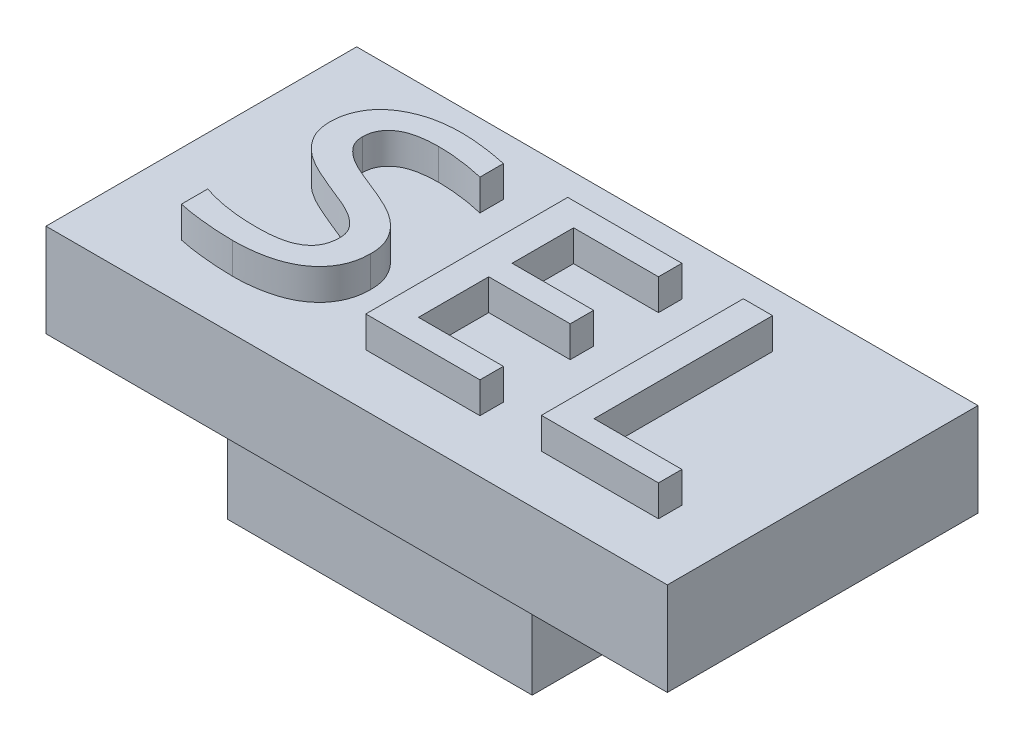
from build123d import *

# Parameters (mm, degrees)
SKETCH1_W           = 20
SKETCH1_H           = 10
BOSS_EXTRUDE1_DEPTH = 3
SKETCH2_W           = 9.8
SKETCH2_H           = 8.5
SKETCH2_W_2         = 5.8
SKETCH2_H_2         = 4.5
BOSS_EXTRUDE2_DEPTH = 3
BOSS_EXTRUDE3_DEPTH = 1


with BuildPart() as part:
    # Sketch1 → Boss-Extrude1 (new body)
    with BuildSketch(Plane(origin=(0, 0, 0), x_dir=(1, 0, 0), z_dir=(0, 1, 0))):
        Rectangle(SKETCH1_W, SKETCH1_H)
    extrude(amount=BOSS_EXTRUDE1_DEPTH)

    # Sketch2 → Boss-Extrude2 (add)
    with BuildSketch(Plane.XZ):
        Rectangle(SKETCH2_W, SKETCH2_H)
        Rectangle(SKETCH2_W_2, SKETCH2_H_2, mode=Mode.SUBTRACT)
    extrude(amount=BOSS_EXTRUDE2_DEPTH)

    # Sketch3 → Boss-Extrude3 (add)
    with BuildSketch(Plane(origin=(0, 3, 0), x_dir=(1, 0, 0), z_dir=(0, 1, 0))):
        with BuildLine():
            add(Edge.make_bspline(
                [(-3.007246377, -1.541055254), (-3.009361723, -1.616266832), (-3.01346546, -1.762176027), (-3.049571221, -1.974490768), (-3.109784234, -2.171698983), (-3.192526507, -2.355150602), (-3.298968583, -2.521513857), (-3.420549524, -2.676791882), (-3.565727351, -2.813375097), (-3.726560117, -2.937740496), (-3.905559946, -3.047190671), (-4.103184871, -3.139302997), (-4.316725708, -3.21887973), (-4.54677574, -3.283042654), (-4.79127798, -3.332920655), (-5.049025563, -3.367185197), (-5.318723514, -3.390311379), (-5.502591678, -3.39288864), (-5.596354167, -3.394202899)],
                knots=[0, 0, 0, 0, 1.005643061, 1.95093061, 2.870738502, 3.757832008, 4.633806625, 5.507195241, 6.389247641, 7.292512577, 8.223494331, 9.189475669, 10.205094408, 11.269007441, 12.381228937, 13.540657028, 14.745872513, 16, 16, 16, 16], degree=3))
            add(Edge.make_bspline(
                [(-5.596354167, -3.394202899), (-5.682718588, -3.393235229), (-5.855033921, -3.391304522), (-6.111280949, -3.379468444), (-6.361973178, -3.359915664), (-6.603364511, -3.33640358), (-6.833625513, -3.310266833), (-7.049705719, -3.280039115), (-7.248879542, -3.244891381), (-7.374986232, -3.218371914), (-7.434782609, -3.205797101)],
                knots=[0, 0, 0, 0, 1.119729043, 2.234096861, 3.324996266, 4.379512959, 5.378439906, 6.329323539, 7.207810484, 8, 8, 8, 8], degree=3))
            Line((-7.434782609, -3.205797101), (-7.434782609, -2.357971014))
            add(Edge.make_bspline(
                [(-7.434782609, -2.357971014), (-7.370762942, -2.379906097), (-7.239954637, -2.424724996), (-7.034769621, -2.477293495), (-6.819537264, -2.526663443), (-6.592212353, -2.567908961), (-6.350580188, -2.600371202), (-6.09371887, -2.623201503), (-5.82076552, -2.638661997), (-5.633665552, -2.639928566), (-5.537477355, -2.64057971)],
                knots=[0, 0, 0, 0, 0.842364813, 1.72116351, 2.635659137, 3.591954833, 4.596841017, 5.670471508, 6.802388115, 8, 8, 8, 8], degree=3))
            add(Edge.make_bspline(
                [(-5.537477355, -2.64057971), (-5.468755519, -2.639872283), (-5.336572064, -2.638511576), (-5.146102436, -2.624285716), (-4.971197978, -2.605738792), (-4.812235473, -2.573524326), (-4.66761954, -2.536445211), (-4.53690496, -2.489260746), (-4.420297965, -2.43310849), (-4.315764365, -2.370159285), (-4.226176786, -2.297427118), (-4.14763217, -2.219043718), (-4.08459987, -2.131603251), (-4.033398257, -2.037180835), (-3.995547608, -1.93545715), (-3.969262703, -1.826700795), (-3.952727851, -1.711319689), (-3.950446508, -1.631881026), (-3.949275362, -1.591100543)],
                knots=[0, 0, 0, 0, 1.523194236, 2.929797672, 4.233142745, 5.41923506, 6.522104548, 7.540643951, 8.494207191, 9.387815665, 10.238903194, 11.04655015, 11.840679357, 12.619387111, 13.4214478, 14.239285369, 15.096122854, 16, 16, 16, 16], degree=3))
            add(Edge.make_bspline(
                [(-3.949275362, -1.591100543), (-3.950736926, -1.548727509), (-3.953592513, -1.465939512), (-3.982760391, -1.347167725), (-4.028364162, -1.237025632), (-4.095221609, -1.138795344), (-4.173790678, -1.046499637), (-4.266091432, -0.961927422), (-4.367978541, -0.880147855), (-4.522576355, -0.777306411), (-4.738901588, -0.6564636), (-5.027071288, -0.535618888), (-5.332657608, -0.414283489), (-5.646271299, -0.28773006), (-5.959805031, -0.153393094), (-6.267393971, -0.011077429), (-6.555877209, 0.152188183), (-6.773110218, 0.314191425), (-6.924884877, 0.460070087), (-7.028139342, 0.576873874), (-7.116736104, 0.704422635), (-7.19857963, 0.83820536), (-7.26261074, 0.986049766), (-7.307035659, 1.146566576), (-7.336517595, 1.31977591), (-7.339194196, 1.439453928), (-7.34057971, 1.501403986)],
                knots=[0, 0, 0, 0, 0.619815692, 1.2109895, 1.781199776, 2.357496674, 2.943929778, 3.554333405, 4.188738872, 4.856760597, 6.272963823, 7.811824644, 9.431291666, 11.092170587, 12.76691914, 14.429617761, 16.056218893, 17.616396577, 18.384212937, 19.138341755, 19.896401647, 20.65718422, 21.4332038, 22.247956952, 23.09307348, 24, 24, 24, 24], degree=3))
            add(Edge.make_bspline(
                [(-7.34057971, 1.501403986), (-7.338890921, 1.55695311), (-7.335509193, 1.668187842), (-7.30757402, 1.834398802), (-7.263639098, 1.99915748), (-7.201785927, 2.161864622), (-7.120766105, 2.318754545), (-7.022162869, 2.469164015), (-6.90104822, 2.607647577), (-6.762169614, 2.738226423), (-6.601498999, 2.857697029), (-6.421044497, 2.966681175), (-6.217870333, 3.06021036), (-5.995865777, 3.145085669), (-5.75055523, 3.212458991), (-5.483154955, 3.260726864), (-5.193612621, 3.28796892), (-4.993414416, 3.292077257), (-4.889832428, 3.294202899)],
                knots=[0, 0, 0, 0, 0.784067079, 1.570060577, 2.373452904, 3.189297991, 4.022898002, 4.862695015, 5.722463422, 6.614650011, 7.550049647, 8.544652583, 9.586108202, 10.704431291, 11.897970904, 13.172772987, 14.537200697, 16, 16, 16, 16], degree=3))
            add(Edge.make_bspline(
                [(-4.889832428, 3.294202899), (-4.831915002, 3.293827656), (-4.71154814, 3.293047807), (-4.526083854, 3.279715221), (-4.332642127, 3.262900288), (-4.135942453, 3.23881275), (-3.939571378, 3.211313867), (-3.746785439, 3.17889299), (-3.561719244, 3.144290109), (-3.441899158, 3.118329271), (-3.384057971, 3.105797101)],
                knots=[0, 0, 0, 0, 0.91416123, 1.89985515, 2.934260182, 3.979599391, 5.027947684, 6.064525625, 7.065681407, 8, 8, 8, 8], degree=3))
            Line((-3.384057971, 3.105797101), (-3.384057971, 2.352173913))
            add(Edge.make_bspline(
                [(-3.384057971, 2.352173913), (-3.512802353, 2.380728564), (-3.769014174, 2.437554648), (-4.154613263, 2.494241446), (-4.53329374, 2.533940296), (-4.78326578, 2.538393033), (-4.906023551, 2.54057971)],
                knots=[0, 0, 0, 0, 1.029411825, 2.048613503, 3.041701399, 4, 4, 4, 4], degree=3))
            add(Edge.make_bspline(
                [(-4.906023551, 2.54057971), (-4.96785961, 2.539634528), (-5.087722119, 2.537802395), (-5.261250093, 2.526537867), (-5.421923855, 2.50591041), (-5.569906649, 2.478011851), (-5.705607433, 2.443486967), (-5.828608574, 2.399624608), (-5.938232428, 2.346084815), (-6.036323458, 2.285929472), (-6.121441499, 2.217830494), (-6.196267253, 2.145534626), (-6.25873862, 2.066920743), (-6.309166265, 1.982002857), (-6.348629922, 1.891910001), (-6.379278296, 1.797018907), (-6.39483351, 1.695718813), (-6.39729289, 1.626561307), (-6.398550725, 1.591191123)],
                knots=[0, 0, 0, 0, 1.491437277, 2.890989782, 4.191431573, 5.395946596, 6.521058188, 7.565423013, 8.539223212, 9.458660202, 10.334655275, 11.163081303, 11.963306063, 12.748694206, 13.538083787, 14.331542868, 15.146677777, 16, 16, 16, 16], degree=3))
            add(Edge.make_bspline(
                [(-6.398550725, 1.591191123), (-6.397090804, 1.54882223), (-6.394238428, 1.466042324), (-6.364939026, 1.346770736), (-6.319091437, 1.236318933), (-6.254990308, 1.135022601), (-6.173334725, 1.044741827), (-6.083461638, 0.956922737), (-5.981213723, 0.874535374), (-5.826918921, 0.769047924), (-5.608685055, 0.648834692), (-5.321927803, 0.522708732), (-5.01464681, 0.404830914), (-4.701773525, 0.277036411), (-4.387114081, 0.144096978), (-4.130666417, 0.020425333), (-3.931637116, -0.085736683), (-3.792159425, -0.174732598), (-3.659724913, -0.268594319), (-3.537951241, -0.372291237), (-3.423674946, -0.481967024), (-3.321521117, -0.602520833), (-3.230395949, -0.731327418), (-3.151822879, -0.869682551), (-3.084616777, -1.017867369), (-3.040791314, -1.18089857), (-3.011296839, -1.356483959), (-3.008627503, -1.478120166), (-3.007246377, -1.541055254)],
                knots=[0, 0, 0, 0, 0.667485538, 1.304126353, 1.925325377, 2.548259058, 3.18485279, 3.841928735, 4.529978862, 5.253739616, 6.789399884, 8.452896455, 10.194043647, 11.982660287, 13.786213269, 15.583473082, 16.473910229, 17.343881083, 18.192645259, 19.033319022, 19.865571682, 20.689426309, 21.522902605, 22.351690537, 23.197589349, 24.082454772, 25.007853999, 26, 26, 26, 26], degree=3))
        make_face()
        Polygon((2.268115942, -3.3), (-1.405797101, -3.3), (-1.405797101, 3.2), (2.268115942, 3.2), (2.268115942, 2.446376812), (-0.463768116, 2.446376812), (-0.463768116, 0.468115942), (2.159193841, 0.468115942), (2.159193841, -0.285507246), (-0.463768116, -0.285507246), (-0.463768116, -2.546376812), (2.268115942, -2.546376812), align=None)
        Polygon((8.014492754, -3.3), (4.246376812, -3.3), (4.246376812, 3.2), (5.188405797, 3.2), (5.188405797, -2.546376812), (8.014492754, -2.546376812), align=None)
    extrude(amount=BOSS_EXTRUDE3_DEPTH)


solid = part.part
